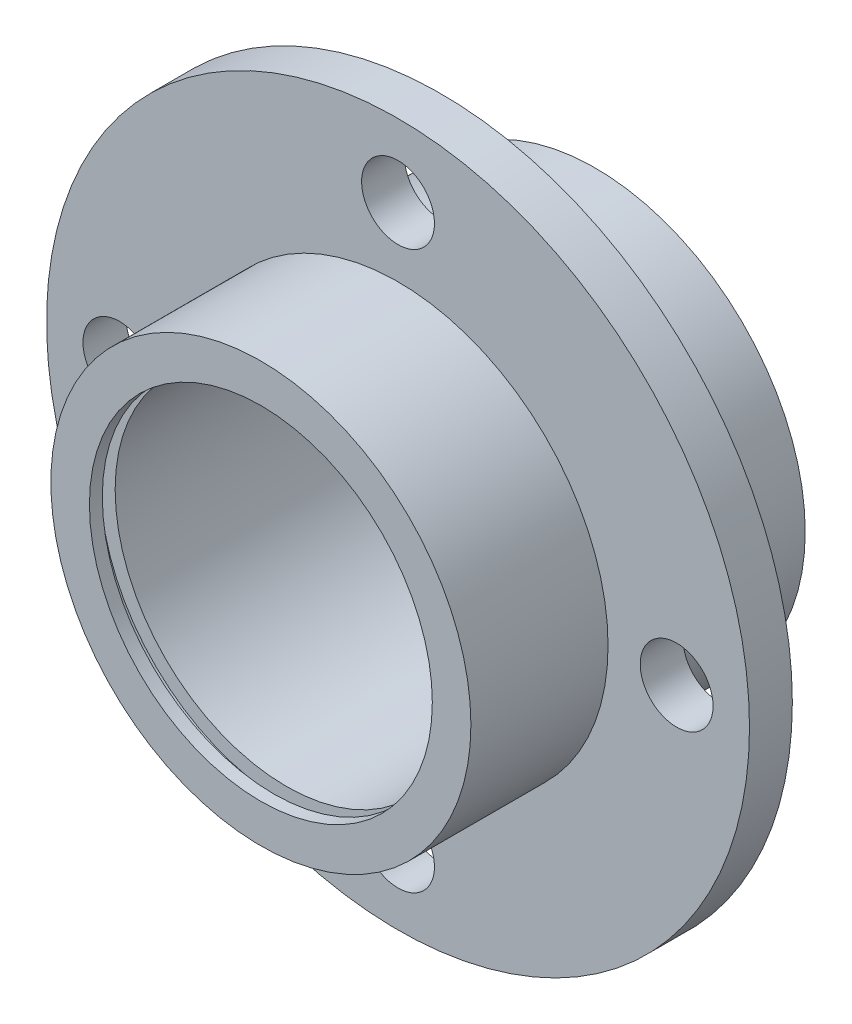
from build123d import *

# Parameters (mm, degrees)
SKETCH_1_R               = 24.5
EXTRUDE_1_DEPTH          = 39
SKETCH_2_R               = 20
CUT_EXTRUDE_1_DEPTH      = 36
SKETCH_3_R               = 15
CUT_EXTRUDE_2_DEPTH      = 50.964987741
CUT_EXTRUDE_START        = 33
SKETCH_4_R               = 21.75
CUT_EXTRUDE_3_DEPTH      = 1.5
EXTRUDE_START            = -21
SKETCH_5_R               = 41
SKETCH_5_R_2             = 24.5
EXTRUDE_2_DEPTH          = 5
SKETCH_6_R               = 4.25
CUT_EXTRUDE_4_DEPTH      = 63.377880695
PATTERN_CIRCULAR_1_COUNT = 4


with BuildPart() as part:
    # 草图1 → 凸台-拉伸1 (new body)
    with BuildSketch(Plane.XY):
        Circle(SKETCH_1_R)
    extrude(amount=EXTRUDE_1_DEPTH)

    # 草图2 → 切除-拉伸1 (cut)
    with BuildSketch(Plane.XY.offset(39)):
        Circle(SKETCH_2_R)
    extrude(amount=-CUT_EXTRUDE_1_DEPTH, mode=Mode.SUBTRACT)

    # 草图3 → 切除-拉伸2 (cut, through all)
    with BuildSketch(Plane.XY.offset(3)):
        Circle(SKETCH_3_R)
    extrude(amount=-CUT_EXTRUDE_2_DEPTH, mode=Mode.SUBTRACT)

    # 草图4 → 切除-拉伸3 (cut)
    with BuildSketch(Plane.XY.offset(3).offset(CUT_EXTRUDE_START)):
        Circle(SKETCH_4_R)
    extrude(amount=CUT_EXTRUDE_3_DEPTH, mode=Mode.SUBTRACT)

    # 草图5 → 凸台-拉伸2 (add)
    with BuildSketch(Plane.XY.offset(39).offset(EXTRUDE_START)):
        Circle(SKETCH_5_R)
        Circle(SKETCH_5_R_2, mode=Mode.SUBTRACT)
    extrude(amount=EXTRUDE_2_DEPTH)

    # 草图6 → 切除-拉伸4 (cut, through all)
    with BuildSketch(Plane.XY.offset(23)):
        with Locations((32.5, 0)):
            Circle(SKETCH_6_R)
    cut_extrude_4 = extrude(amount=-CUT_EXTRUDE_4_DEPTH, mode=Mode.SUBTRACT)

    # 阵列(圆周)1: 切除-拉伸4 ×4 about axis
    pattern_circular_1_axis = Axis((0, 0, 0), (0, 0, 1))
    for i in range(1, PATTERN_CIRCULAR_1_COUNT):
        add(cut_extrude_4.rotate(pattern_circular_1_axis, i * 360 / PATTERN_CIRCULAR_1_COUNT), mode=Mode.SUBTRACT)


solid = part.part
